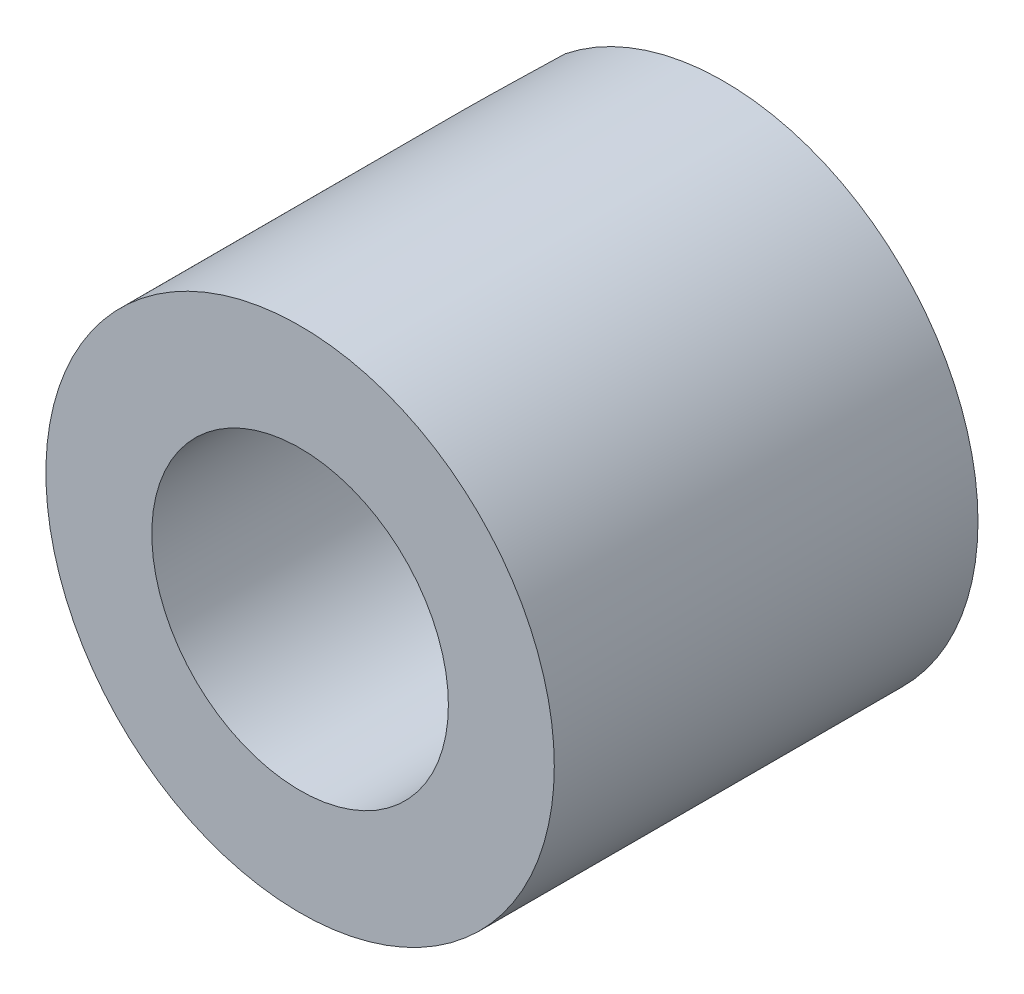
from build123d import *

# Parameters (mm, degrees)
ESQUISSE1_R             = 3
ESQUISSE1_R_2           = 1.75
BASE_EXTRUSION_DEPTH    = 5
ESQUISSE2_R             = 7
ENL_V_MAT_EXTRU_1_DEPTH = 5


with BuildPart() as part:
    # Esquisse1 → Base-Extrusion (new body)
    with BuildSketch(Plane.XY):
        Circle(ESQUISSE1_R)
        Circle(ESQUISSE1_R_2, mode=Mode.SUBTRACT)
    extrude(amount=BASE_EXTRUSION_DEPTH)

    # Esquisse2 → Enlèv. mat.-Extru.1 (cut, symmetric)
    with BuildSketch(Plane(origin=(0, 0, 0), x_dir=(1, 0, 0), z_dir=(0, 1, 0))):
        with Locations((-8.8, 1)):
            Circle(ESQUISSE2_R)
    extrude(amount=ENL_V_MAT_EXTRU_1_DEPTH, both=True, mode=Mode.SUBTRACT)


solid = part.part
